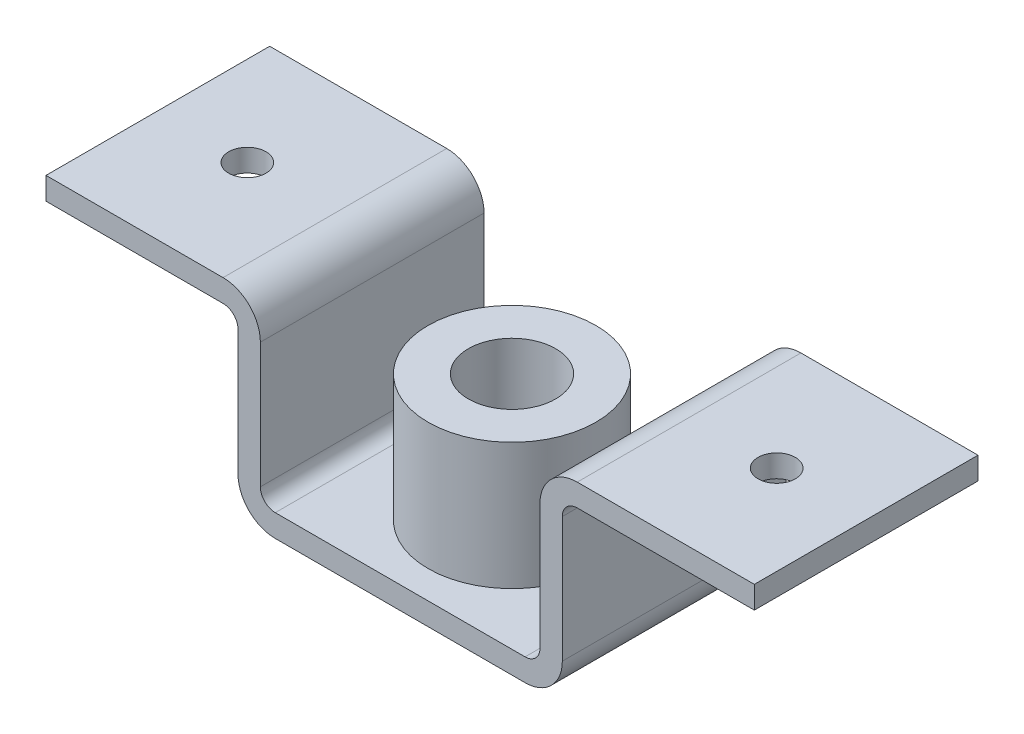
from build123d import *

# Parameters (mm, degrees)
BOSS_EXTRUDE1_DEPTH = 150
FILLET1_R           = 20
FILLET2_R           = 50
SKETCH2_R           = 25
CUT_EXTRUDE1_DEPTH  = 566.640345096
SKETCH3_R           = 112.5
SKETCH3_R_2         = 58.5
BOSS_EXTRUDE2_DEPTH = 170


with BuildPart() as part:
    # Sketch1 → Boss-Extrude1 (new, symmetric)
    with BuildSketch(Plane.XY):
        Polygon((-187.5, 0), (187.5, 0), (187.5, 238), (475, 238), (475, 208), (217.5, 208), (217.5, -30), (-217.5, -30), (-217.5, 208), (-475, 208), (-475, 238), (-187.5, 238), align=None)
    extrude(amount=BOSS_EXTRUDE1_DEPTH, both=True)

    # Fillet1
    fillet1_edges = [part.edges().sort_by_distance(p)[0] for p in [
        (-187.5, 0, 0),
        (187.5, 0, 0),
        (217.5, 208, 0),
        (-217.5, 208, 0),
    ]]
    fillet(fillet1_edges, radius=FILLET1_R)

    # Fillet2
    fillet2_edges = [part.edges().sort_by_distance(p)[0] for p in [
        (187.5, 238, 0),
        (217.5, -30, 0),
        (-217.5, -30, 0),
        (-187.5, 238, 0),
    ]]
    fillet(fillet2_edges, radius=FILLET2_R)

    # Sketch2 → Cut-Extrude1 (cut, through all)
    with BuildSketch(Plane(origin=(0, 238, 0), x_dir=(1, 0, 0), z_dir=(0, 1, 0))):
        with Locations(Location((-355, 0, 0), (0, 0, 180))):
            Circle(SKETCH2_R)
        with Locations(Location((355, 0, 0), (0, 0, 270))):
            Circle(SKETCH2_R)
    extrude(amount=-CUT_EXTRUDE1_DEPTH, mode=Mode.SUBTRACT)

    # Sketch3 → Boss-Extrude2 (add)
    with BuildSketch(Plane(origin=(0, 0, 0), x_dir=(1, 0, 0), z_dir=(0, 1, 0))):
        with Locations(Location((0, 0, 0), (0, 0, 90))):
            Circle(SKETCH3_R)
        with Locations(Location((0, 0, 0), (0, 0, 270))):
            Circle(SKETCH3_R_2, mode=Mode.SUBTRACT)
    extrude(amount=BOSS_EXTRUDE2_DEPTH)


solid = part.part
